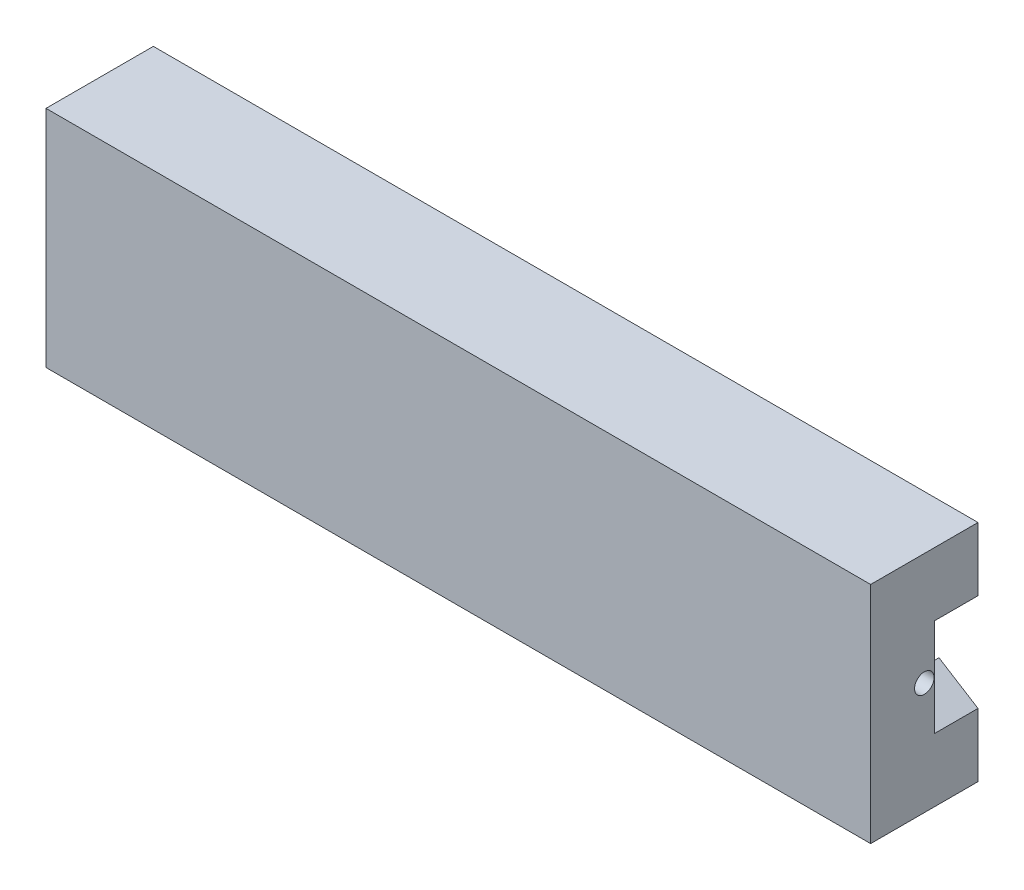
from build123d import *

# Parameters (mm, degrees)
SKETCH1_W               = 76.5
SKETCH1_H               = 15
BOSS_EXTRUDE1_DEPTH     = 3
SKETCH2_R               = 1
CUT_EXTRUDE1_DEPTH      = 77.92528843
SKETCH3_W               = 84.5
SKETCH3_H               = 23
BOSS_EXTRUDE2_DEPTH     = 7
CUT_EXTRUDE2_DEPTH      = 82.618012718
CUT_EXTRUDE2_DEPTH_BACK = 82.618012718
SKETCH4_R               = 1
SKETCH5_W               = 77.5
SKETCH5_H               = 16
SKETCH5_W_2             = 76.5
SKETCH5_H_2             = 15
CUT_EXTRUDE4_DEPTH      = 0.48
SKETCH10_W              = 84.5
SKETCH10_H              = 23
SKETCH10_W_2            = 76.5
SKETCH10_H_2            = 15
BOSS_EXTRUDE7_DEPTH     = 2
SKETCH11_W              = 77.5
SKETCH11_H              = 16
SKETCH11_W_2            = 76.5
SKETCH11_H_2            = 15
CUT_EXTRUDE5_DEPTH      = 0.45
SKETCH13_W              = 84.5
SKETCH13_H              = 23
SKETCH13_W_2            = 76.5
SKETCH13_H_2            = 15
BOSS_EXTRUDE8_DEPTH     = 2
CUT_EXTRUDE6_START      = -4.48
CUT_EXTRUDE6_DEPTH      = 4.48


with BuildPart() as part:
    # Sketch1 → Boss-Extrude1 (new body)
    with BuildSketch(Plane.XY):
        Rectangle(SKETCH1_W, SKETCH1_H)
    extrude(amount=BOSS_EXTRUDE1_DEPTH)

    # Sketch2 → Cut-Extrude1 (cut, through all)
    with BuildSketch(Plane(origin=(38.25, 0, 0), x_dir=(0, 0, -1), z_dir=(1, 0, 0))):
        with Locations((-1.5, 0)):
            Circle(SKETCH2_R)
    extrude(amount=-CUT_EXTRUDE1_DEPTH, mode=Mode.SUBTRACT)


with BuildPart() as body_2:
    # Sketch3 → Boss-Extrude2 (new body)
    with BuildSketch(Plane(origin=(0, 0, 0), x_dir=(-1, 0, 0), z_dir=(0, 0, -1))):
        Rectangle(SKETCH3_W, SKETCH3_H)
    extrude(amount=-BOSS_EXTRUDE2_DEPTH)

    # Combine1: cut part
    add(part.part, mode=Mode.SUBTRACT)

    # Sketch4 → Cut-Extrude2 (cut, two sides: drawn at the far end of the back side and taken through both)
    with BuildSketch(Plane.ZY.offset(-38.25).offset(-CUT_EXTRUDE2_DEPTH_BACK)):
        with Locations((1.5, 0)):
            Circle(SKETCH4_R)
    extrude(amount=CUT_EXTRUDE2_DEPTH + CUT_EXTRUDE2_DEPTH_BACK, mode=Mode.SUBTRACT)

    # Sketch5 → Cut-Extrude4 (cut)
    with BuildSketch(Plane(origin=(0, 0, 0), x_dir=(-1, 0, 0), z_dir=(0, 0, -1))):
        Rectangle(SKETCH5_W, SKETCH5_H)
        Rectangle(SKETCH5_W_2, SKETCH5_H_2, mode=Mode.SUBTRACT)
    extrude(amount=-CUT_EXTRUDE4_DEPTH, mode=Mode.SUBTRACT)

    # Sketch10 → Boss-Extrude7 (add)
    with BuildSketch(Plane(origin=(0, 0, 0), x_dir=(-1, 0, 0), z_dir=(0, 0, -1))):
        Rectangle(SKETCH10_W, SKETCH10_H)
        Rectangle(SKETCH10_W_2, SKETCH10_H_2, mode=Mode.SUBTRACT)
    extrude(amount=BOSS_EXTRUDE7_DEPTH)

    # Sketch11 → Cut-Extrude5 (cut)
    with BuildSketch(Plane(origin=(0, 0, -2), x_dir=(-1, 0, 0), z_dir=(0, 0, -1))):
        Rectangle(SKETCH11_W, SKETCH11_H)
        Rectangle(SKETCH11_W_2, SKETCH11_H_2, mode=Mode.SUBTRACT)
    extrude(amount=-CUT_EXTRUDE5_DEPTH, mode=Mode.SUBTRACT)

    # Sketch13 → Boss-Extrude8 (add)
    with BuildSketch(Plane(origin=(0, 0, -2), x_dir=(-1, 0, 0), z_dir=(0, 0, -1))):
        Rectangle(SKETCH13_W, SKETCH13_H)
        Rectangle(SKETCH13_W_2, SKETCH13_H_2, mode=Mode.SUBTRACT)
    extrude(amount=BOSS_EXTRUDE8_DEPTH)

    # Sketch14 → Cut-Extrude6 (cut)
    with BuildSketch(Plane(origin=(0, 0, -4), x_dir=(-1, 0, 0), z_dir=(0, 0, -1)).offset(CUT_EXTRUDE6_START)):
        Polygon((-42.25, -5), (-38.25, -2.5), (-38.25, 2.5), (-42.25, 5), align=None)
    extrude(amount=CUT_EXTRUDE6_DEPTH, mode=Mode.SUBTRACT)


solid = body_2.part
